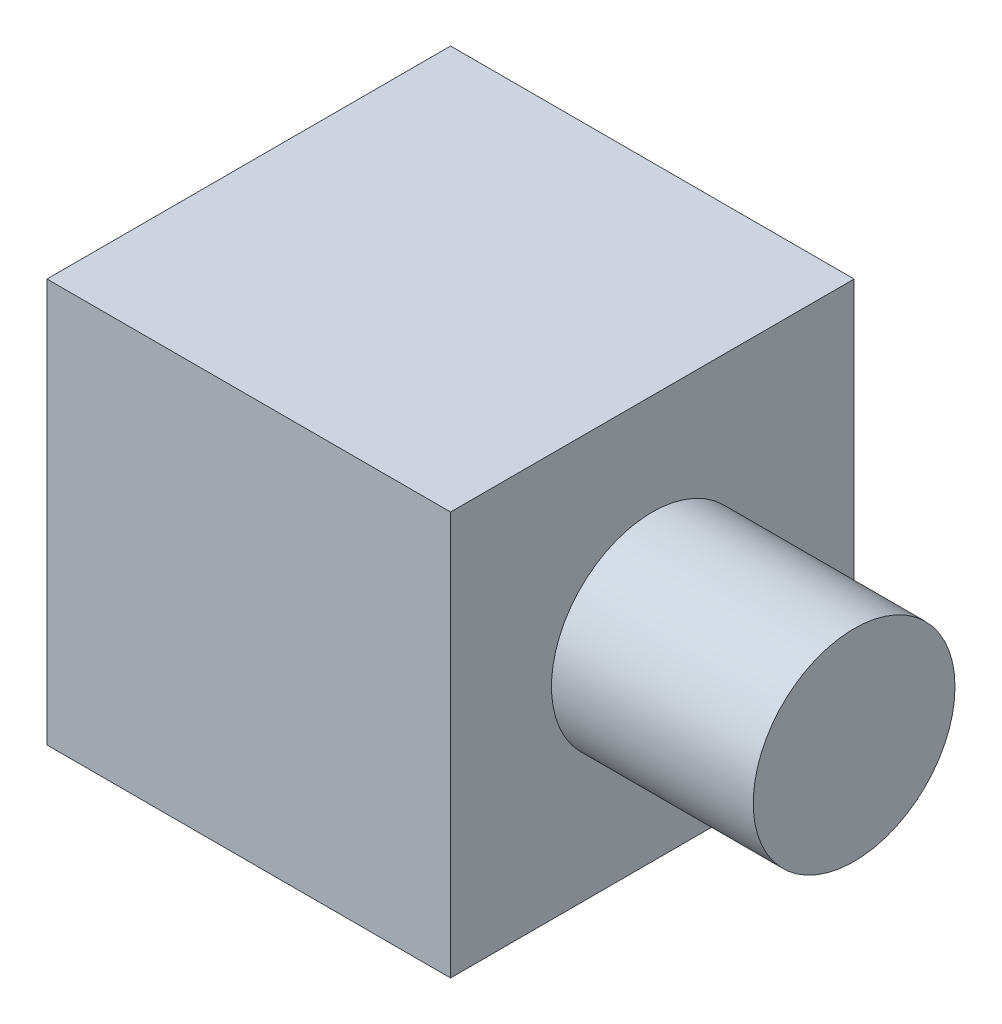
from build123d import *

# Parameters (mm, degrees)
SKETCH_1_W      = 20
SKETCH_1_H      = 20
EXTRUDE_1_DEPTH = 10
SKETCH_2_R      = 5
EXTRUDE_2_DEPTH = 10


with BuildPart() as part:
    # 草图1 → 凸台-拉伸1 (new, symmetric)
    with BuildSketch(Plane.XY):
        Rectangle(SKETCH_1_W, SKETCH_1_H)
    extrude(amount=EXTRUDE_1_DEPTH, both=True)

    # 草图2 → 凸台-拉伸2 (add)
    with BuildSketch(Plane(origin=(10, 0, 0), x_dir=(0, 0, -1), z_dir=(1, 0, 0))):
        Circle(SKETCH_2_R)
    extrude(amount=EXTRUDE_2_DEPTH)


solid = part.part
